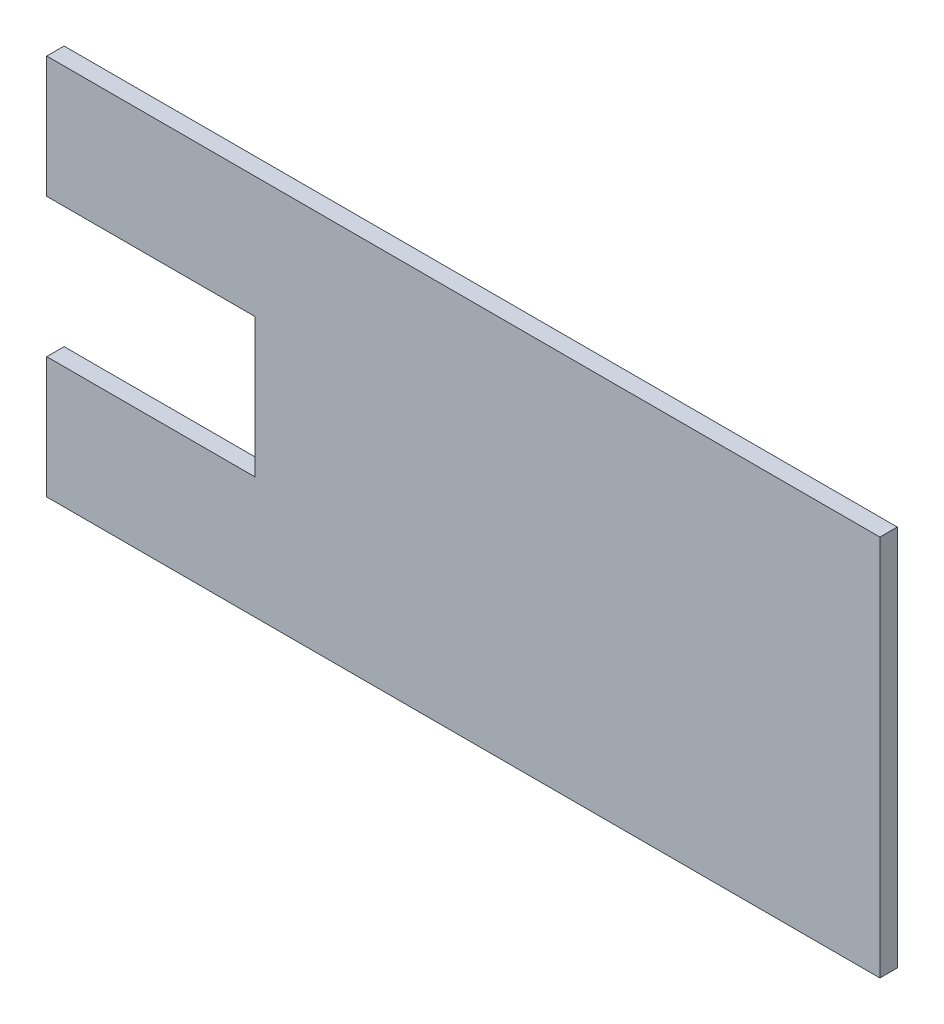
from build123d import *

# Parameters (mm, degrees)
SKETCH1_W           = 152.4
SKETCH1_H           = 69.85
BOSS_EXTRUDE1_DEPTH = 3.175
SKETCH2_W           = 38.1
SKETCH2_H           = 25.4
CUT_EXTRUDE1_DEPTH  = 168.674873267


with BuildPart() as part:
    # Sketch1 → Boss-Extrude1 (new body)
    with BuildSketch(Plane.XY):
        with Locations((76.2, 34.925)):
            Rectangle(SKETCH1_W, SKETCH1_H)
    extrude(amount=BOSS_EXTRUDE1_DEPTH)

    # Sketch2 → Cut-Extrude1 (cut, through all)
    with BuildSketch(Plane.XY.offset(3.175)):
        with Locations((19.05, 34.925)):
            Rectangle(SKETCH2_W, SKETCH2_H)
    extrude(amount=-CUT_EXTRUDE1_DEPTH, mode=Mode.SUBTRACT)


solid = part.part
